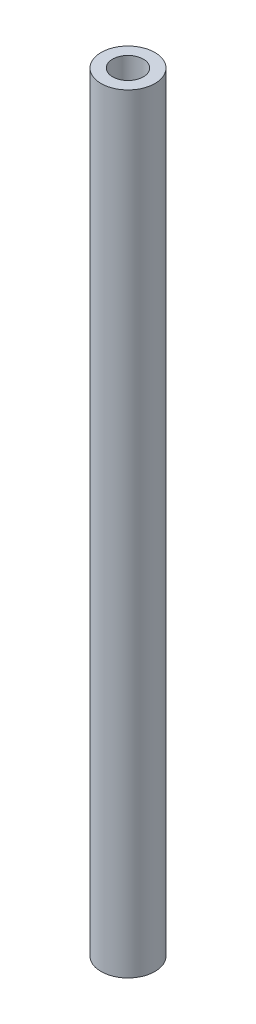
from build123d import *

# Parameters (mm, degrees)
SKETCH_1_R      = 1.75
SKETCH_1_R_2    = 1
EXTRUDE_1_DEPTH = 50


with BuildPart() as part:
    # 草图1 → 凸台-拉伸1 (new body)
    with BuildSketch(Plane(origin=(0, 0, 0), x_dir=(1, 0, 0), z_dir=(0, 1, 0))):
        with Locations(Location((0, 0, 0), (0, 0, 270))):
            Circle(SKETCH_1_R)
        with Locations(Location((0, 0, 0), (0, 0, 270))):
            Circle(SKETCH_1_R_2, mode=Mode.SUBTRACT)
    extrude(amount=EXTRUDE_1_DEPTH)


solid = part.part
